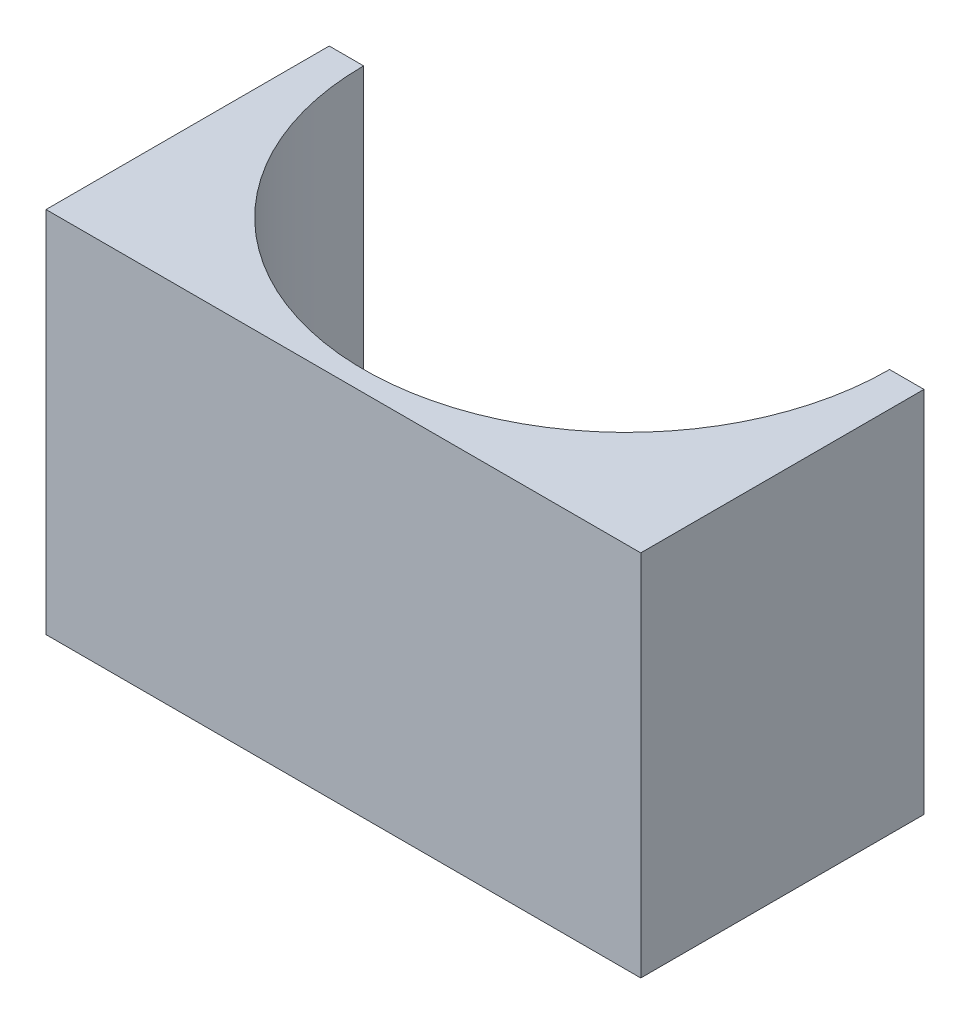
from build123d import *

# Parameters (mm, degrees)
SKETCH1_W           = 73.5
SKETCH1_H           = 35
BOSS_EXTRUDE1_DEPTH = 45.5
SKETCH2_R           = 32.5
CUT_EXTRUDE1_DEPTH  = 62.049672399


with BuildPart() as part:
    # Sketch1 → Boss-Extrude1 (new body)
    with BuildSketch(Plane(origin=(0, 0, 0), x_dir=(1, 0, 0), z_dir=(0, 1, 0))):
        Rectangle(SKETCH1_W, SKETCH1_H)
    extrude(amount=BOSS_EXTRUDE1_DEPTH)

    # Sketch2 → Cut-Extrude1 (cut, through all)
    with BuildSketch(Plane(origin=(0, 45.5, 0), x_dir=(1, 0, 0), z_dir=(0, 1, 0))):
        with Locations((0, 17.5)):
            Circle(SKETCH2_R)
    extrude(amount=-CUT_EXTRUDE1_DEPTH, mode=Mode.SUBTRACT)


solid = part.part
